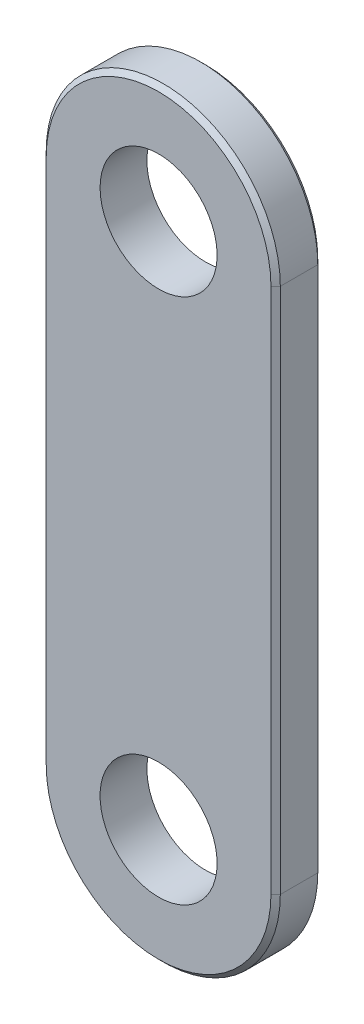
from build123d import *

# Parameters (mm, degrees)
BOSS_EXTRUDE1_DEPTH      = 10
BOSS_EXTRUDE1_DEPTH_BACK = 10
SKETCH1_R                = 25
CHAMFER1_SIZE            = 2


with BuildPart() as part:
    # Sketch1 → Boss-Extrude1 (new, two sides: drawn at the far end of the back side and taken through both)
    with BuildSketch(Plane.XY.offset(-BOSS_EXTRUDE1_DEPTH_BACK)):
        with BuildLine():
            Line((-50, 0), (-50, 225))
            ThreePointArc((-50, 225), (0, 275), (50, 225))
            Line((50, 225), (50, 0))
            ThreePointArc((50, 0), (0, -50), (-50, 0))
        make_face()
        Circle(SKETCH1_R, mode=Mode.SUBTRACT)
        with Locations((0, 225)):
            Circle(SKETCH1_R, mode=Mode.SUBTRACT)
    extrude(amount=BOSS_EXTRUDE1_DEPTH + BOSS_EXTRUDE1_DEPTH_BACK)

    # Chamfer1
    chamfer1_edges = [part.edges().sort_by_distance(p)[0] for p in [
        (-50, 112.5, -10),
        (0, -50, -10),
        (0, 275, -10),
        (50, 112.5, -10),
        (0, -50, 10),
        (50, 112.5, 10),
        (-50, 112.5, 10),
        (0, 275, 10),
    ]]
    chamfer(chamfer1_edges, length=CHAMFER1_SIZE)


solid = part.part
